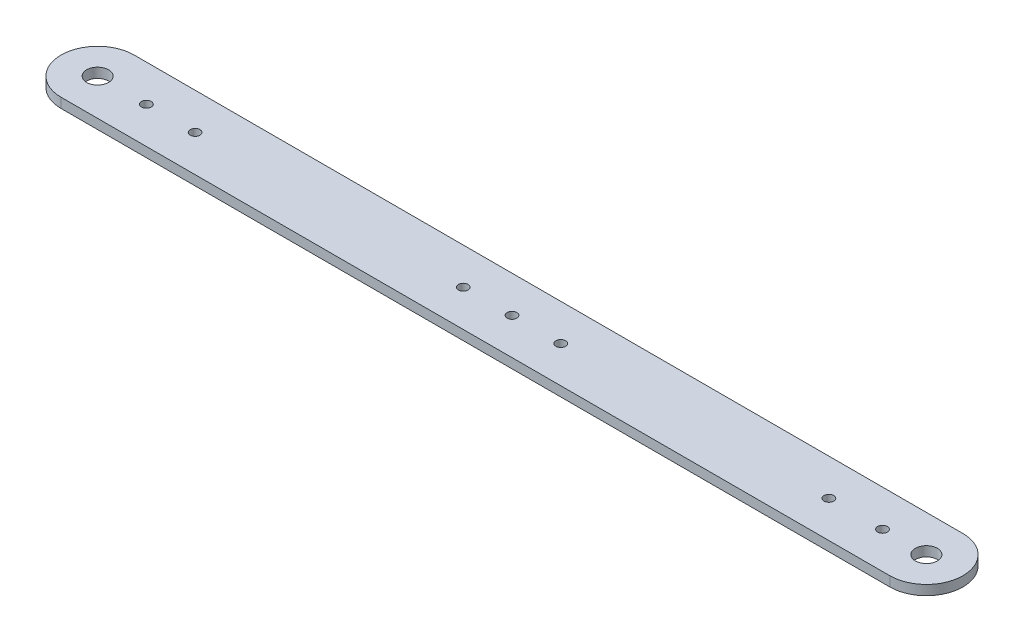
from build123d import *

# Parameters (mm, degrees)
SKETCH1_R           = 4.5
SKETCH1_R_2         = 2
BOSS_EXTRUDE1_DEPTH = 4


with BuildPart() as part:
    # Sketch1 → Boss-Extrude1 (new body)
    with BuildSketch(Plane(origin=(0, 0, 0), x_dir=(1, 0, 0), z_dir=(0, 1, 0))):
        with BuildLine():
            Line((-170, 15), (170, 15))
            ThreePointArc((170, 15), (185, 0), (170, -15))
            Line((170, -15), (-170, -15))
            ThreePointArc((-170, -15), (-185, 0), (-170, 15))
        make_face()
        with Locations(Location((-170, 0, 0), (0, 0, 270))):
            Circle(SKETCH1_R, mode=Mode.SUBTRACT)
        with Locations(Location((170, 0, 0), (0, 0, 270))):
            Circle(SKETCH1_R, mode=Mode.SUBTRACT)
        with Locations(Location((-150, 0, 0), (0, 0, 270))):
            Circle(SKETCH1_R_2, mode=Mode.SUBTRACT)
        with Locations(Location((152, 0, 0), (0, 0, 270))):
            Circle(SKETCH1_R_2, mode=Mode.SUBTRACT)
        with Locations(Location((0, 0, 0), (0, 0, 270))):
            Circle(SKETCH1_R_2, mode=Mode.SUBTRACT)
        with Locations(Location((-130, 0, 0), (0, 0, 270))):
            Circle(SKETCH1_R_2, mode=Mode.SUBTRACT)
        with Locations(Location((-20, 0, 0), (0, 0, 270))):
            Circle(SKETCH1_R_2, mode=Mode.SUBTRACT)
        with Locations(Location((20, 0, 0), (0, 0, 90))):
            Circle(SKETCH1_R_2, mode=Mode.SUBTRACT)
        with Locations(Location((130, 0, 0), (0, 0, 90))):
            Circle(SKETCH1_R_2, mode=Mode.SUBTRACT)
    extrude(amount=BOSS_EXTRUDE1_DEPTH)


solid = part.part
